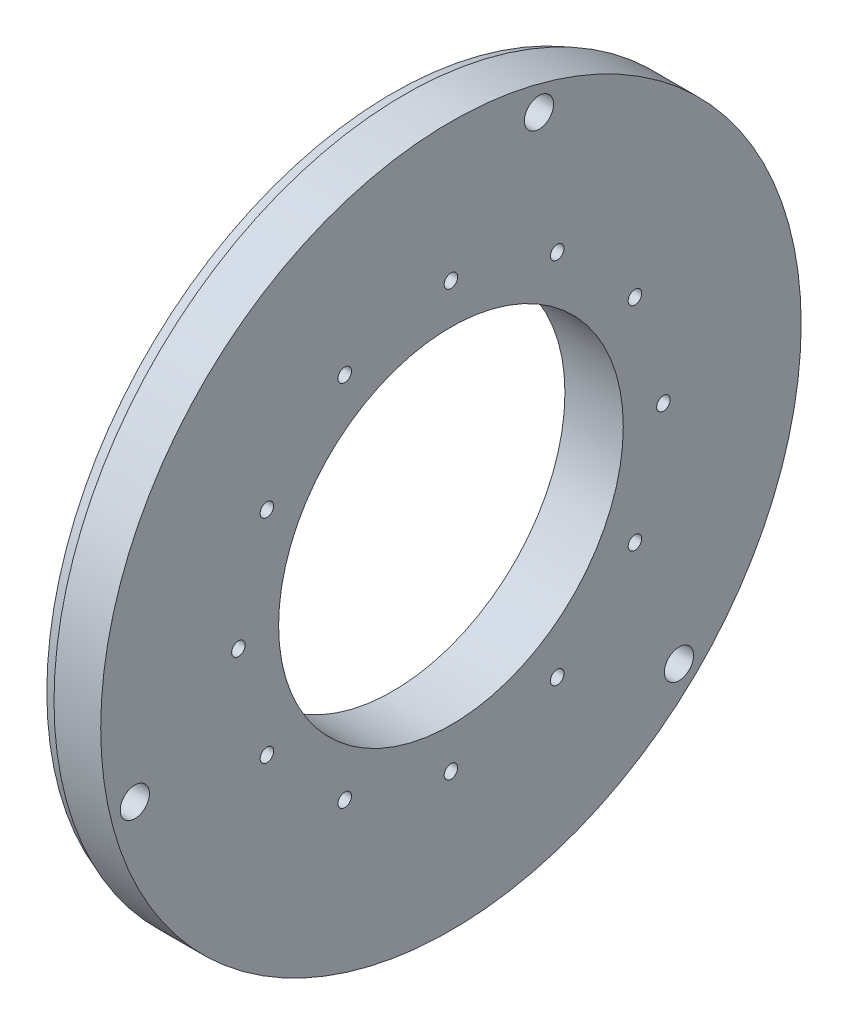
from build123d import *

# Parameters (mm, degrees)
SKETCH1_R           = 76.2
BOSS_EXTRUDE1_DEPTH = 12.7
SKETCH2_R           = 37.5
CUT_EXTRUDE1_DEPTH  = 109.508847566
SKETCH8_R           = 1.4732
CUT_EXTRUDE3_DEPTH  = 109.508847566
CIRPATTERN6_COUNT   = 12
SKETCH11_R          = 3.175
CUT_EXTRUDE4_DEPTH  = 109.508847566
CIRPATTERN7_COUNT   = 3
SKETCH13_OUTSIDE_W  = 197.58
SKETCH13_OUTSIDE_H  = 197.58
SKETCH13_OUTSIDE_R  = 75.2221
CUT_EXTRUDE5_DEPTH  = 2.54


with BuildPart() as part:
    # Sketch1 → Boss-Extrude1 (new body)
    with BuildSketch(Plane(origin=(0, 0, 0), x_dir=(0, 0, -1), z_dir=(1, 0, 0))):
        Circle(SKETCH1_R)
    extrude(amount=BOSS_EXTRUDE1_DEPTH)

    # Sketch2 → Cut-Extrude1 (cut, through all)
    with BuildSketch(Plane(origin=(12.7, 0, 0), x_dir=(0, 0, -1), z_dir=(1, 0, 0))):
        Circle(SKETCH2_R)
    extrude(amount=-CUT_EXTRUDE1_DEPTH, mode=Mode.SUBTRACT)

    # Sketch8 → Cut-Extrude3 (cut, through all)
    with BuildSketch(Plane(origin=(12.7, 0, 0), x_dir=(0, 0, -1), z_dir=(1, 0, 0))):
        with Locations((0, 46.228)):
            Circle(SKETCH8_R)
    cut_extrude3 = extrude(amount=-CUT_EXTRUDE3_DEPTH, mode=Mode.SUBTRACT)

    # CirPattern6: Cut-Extrude3 ×12 about axis
    cirpattern6_axis = Axis((0, 0, 0), (1, 0, 0))
    for i in range(1, CIRPATTERN6_COUNT):
        add(cut_extrude3.rotate(cirpattern6_axis, i * 360 / CIRPATTERN6_COUNT), mode=Mode.SUBTRACT)

    # Sketch11 → Cut-Extrude4 (cut, through all)
    with BuildSketch(Plane(origin=(12.7, 0, 0), x_dir=(0, 0, -1), z_dir=(1, 0, 0))):
        with Locations((19.159653756, 68.353359348)):
            Circle(SKETCH11_R)
    cut_extrude4 = extrude(amount=-CUT_EXTRUDE4_DEPTH, mode=Mode.SUBTRACT)

    # CirPattern7: Cut-Extrude4 ×3 about axis
    cirpattern7_axis = Axis((0, 0, 0), (1, 0, 0))
    for i in range(1, CIRPATTERN7_COUNT):
        add(cut_extrude4.rotate(cirpattern7_axis, i * 360 / CIRPATTERN7_COUNT), mode=Mode.SUBTRACT)

    # Sketch13 outside → Cut-Extrude5 (cut)
    with BuildSketch(Plane.ZY):
        Rectangle(SKETCH13_OUTSIDE_W, SKETCH13_OUTSIDE_H)
        Circle(SKETCH13_OUTSIDE_R, mode=Mode.SUBTRACT)
    extrude(amount=-CUT_EXTRUDE5_DEPTH, mode=Mode.SUBTRACT)


solid = part.part
